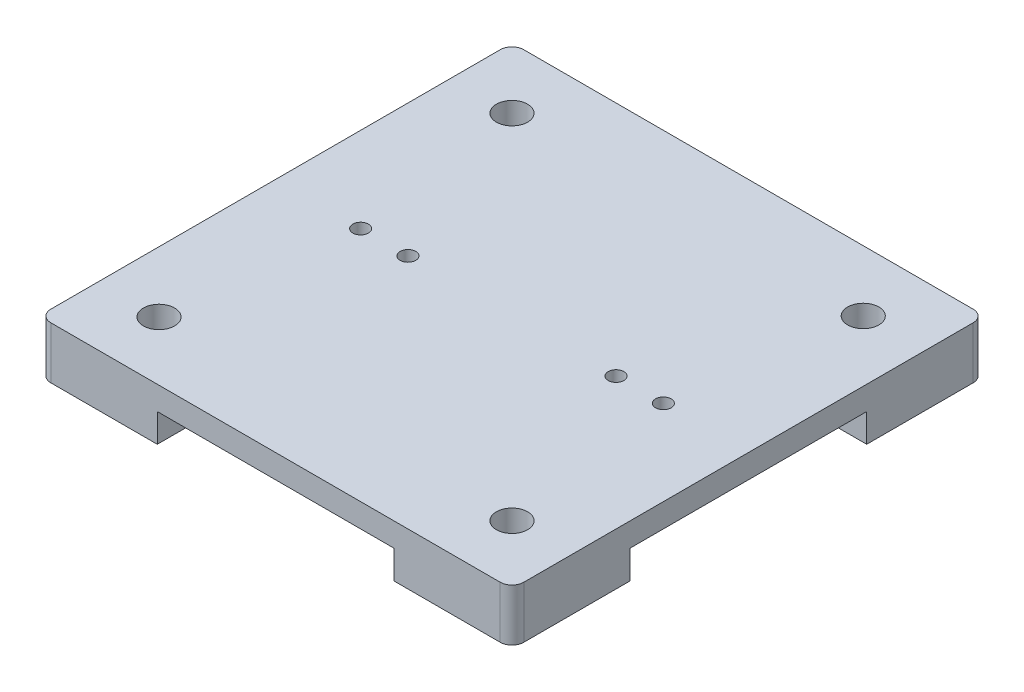
from build123d import *

# Parameters (mm, degrees)
BOSS_EXTRUDE1_DEPTH  = 5
BOSS_EXTRUDE2_START  = 6
BOSS_EXTRUDE2_DEPTH  = 6
SKETCH1_3_R          = 1.65
CUT_EXTRUDE1_DEPTH   = 71.964779997
M6_CLEARANCE_HOLE2_D = 6.6


with BuildPart() as part:
    # Sketch1 → Boss-Extrude1 (new body)
    with BuildSketch(Plane(origin=(0, 0, 0), x_dir=(1, 0, 0), z_dir=(0, 1, 0))):
        with BuildLine():
            Line((-47.5, 50), (47.5, 50))
            ThreePointArc((47.5, 50), (49.267766953, 49.267766953), (50, 47.5))
            Line((50, 47.5), (50, -47.5))
            ThreePointArc((50, -47.5), (49.267766953, -49.267766953), (47.5, -50))
            Line((47.5, -50), (-47.5, -50))
            ThreePointArc((-47.5, -50), (-49.267766953, -49.267766953), (-50, -47.5))
            Line((-50, -47.5), (-50, 47.5))
            ThreePointArc((-50, 47.5), (-49.267766953, 49.267766953), (-47.5, 50))
        make_face()
    extrude(amount=BOSS_EXTRUDE1_DEPTH)

    # Sketch2 → Boss-Extrude2 (add)
    with BuildSketch(Plane.XZ.offset(BOSS_EXTRUDE2_START)):
        with BuildLine():
            Line((-25, 25), (-50, 25))
            Line((-50, 25), (-50, 47.5))
            ThreePointArc((-50, 47.5), (-49.267766953, 49.267766953), (-47.5, 50))
            Line((-47.5, 50), (-25, 50))
            Line((-25, 50), (-25, 25))
        make_face()
        with BuildLine():
            Line((25, 25), (50, 25))
            Line((50, 25), (50, 47.5))
            ThreePointArc((50, 47.5), (49.267766953, 49.267766953), (47.5, 50))
            Line((47.5, 50), (25, 50))
            Line((25, 50), (25, 25))
        make_face()
        with BuildLine():
            Line((25, -25), (50, -25))
            Line((50, -25), (50, -47.5))
            ThreePointArc((50, -47.5), (49.267766953, -49.267766953), (47.5, -50))
            Line((47.5, -50), (25, -50))
            Line((25, -50), (25, -25))
        make_face()
        with BuildLine():
            Line((-25, -25), (-50, -25))
            Line((-50, -25), (-50, -47.5))
            ThreePointArc((-50, -47.5), (-49.267766953, -49.267766953), (-47.5, -50))
            Line((-47.5, -50), (-25, -50))
            Line((-25, -50), (-25, -25))
        make_face()
    extrude(amount=-BOSS_EXTRUDE2_DEPTH)

    # Sketch1<3> → Cut-Extrude1 (cut, through all)
    with BuildSketch(Plane(origin=(0, 0, 0), x_dir=(1, 0, 0), z_dir=(0, 1, 0))):
        with Locations((-32, 0)):
            Circle(SKETCH1_3_R)
        with Locations((-22, 0)):
            Circle(SKETCH1_3_R)
        with Locations((22, 0)):
            Circle(SKETCH1_3_R)
        with Locations((32, 0)):
            Circle(SKETCH1_3_R)
    extrude(amount=CUT_EXTRUDE1_DEPTH, mode=Mode.SUBTRACT)

    # M6 Clearance Hole2 (through all)
    with Locations(Plane(origin=(0, 5, 0), x_dir=(1, 0, 0), z_dir=(0, 1, 0))):
        with Locations((-37.133883476, 37.133883476), (37.5, -37.5), (-37.133883476, -37.5), (37.133883476, 37.133883476)):
            Hole(M6_CLEARANCE_HOLE2_D / 2)


solid = part.part
